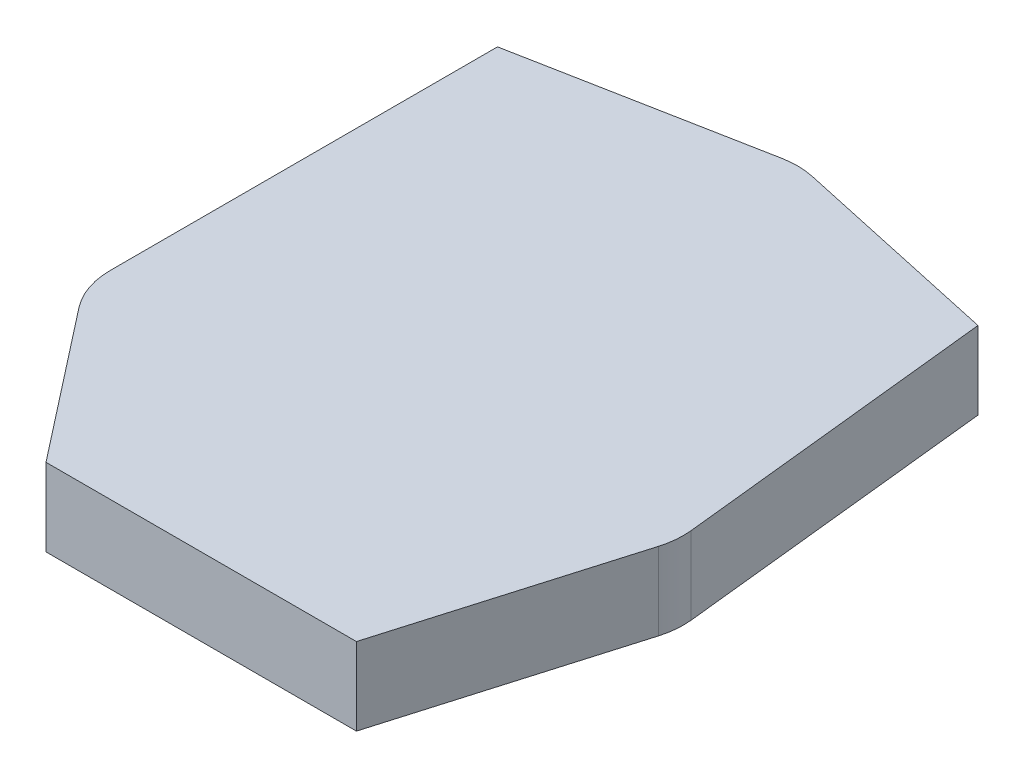
from build123d import *

# Parameters (mm, degrees)
EXTRUDE_1_DEPTH = 15
FILLET_1_R      = 15
FILLET_2_R      = 15
FILLET_3_R      = 15


with BuildPart() as part:
    # Эскиз1 → Бобышка-Вытянуть1 (new body)
    with BuildSketch(Plane(origin=(0, 0, 0), x_dir=(1, 0, 0), z_dir=(0, 1, 0))):
        Polygon((0, 0), (-25.909847732, 33.174508492), (-25.909847732, 113.174508492), (23.200748024, 122.563298857), (67.167075345, 112.973613675), (74.090152268, 47.973613675), (60, 0), align=None)
    extrude(amount=EXTRUDE_1_DEPTH)

    # Скругление1
    fillet_1_edges = [part.edges().sort_by_distance(p)[0] for p in [
        (-25.909847732, 7.5, -33.174508492),
    ]]
    fillet(fillet_1_edges, radius=FILLET_1_R)

    # Скругление2
    fillet_2_edges = [part.edges().sort_by_distance(p)[0] for p in [
        (74.090152268, 7.5, -47.973613675),
    ]]
    fillet(fillet_2_edges, radius=FILLET_2_R)

    # Скругление3
    fillet_3_edges = [part.edges().sort_by_distance(p)[0] for p in [
        (23.200748024, 7.5, -122.563298857),
    ]]
    fillet(fillet_3_edges, radius=FILLET_3_R)


solid = part.part
